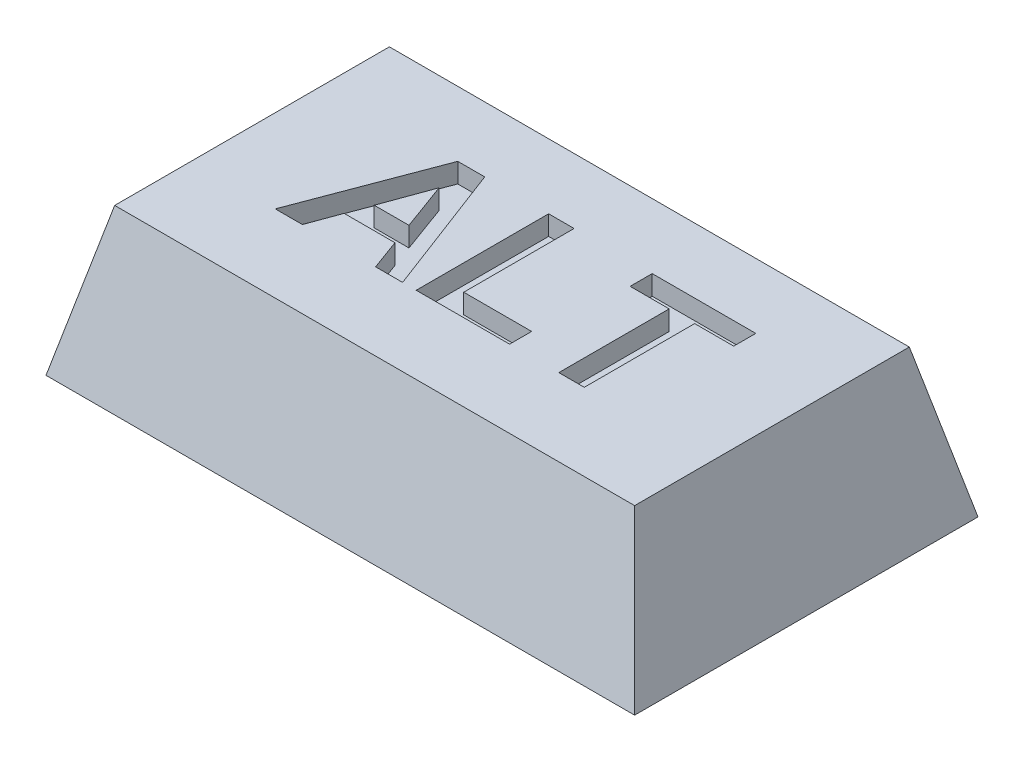
from build123d import *

# Parameters (mm, degrees)
SKETCH1_W               = 12
SKETCH1_H               = 7
BOSS_EXTRUDE1_DEPTH     = 3
CUT_EXTRUDE1_DEPTH      = 7
CUT_EXTRUDE2_DEPTH      = 15.212670404
CUT_EXTRUDE2_DEPTH_BACK = 15.212670404
SKETCH4_R               = 1.8
CUT_EXTRUDE3_DEPTH      = 0.8
CUT_EXTRUDE4_DEPTH      = 0.4


with BuildPart() as part:
    # Sketch1 → Boss-Extrude1 (new body)
    with BuildSketch(Plane(origin=(0, 0, 0), x_dir=(1, 0, 0), z_dir=(0, 1, 0))):
        with Locations((6, 3.5)):
            Rectangle(SKETCH1_W, SKETCH1_H)
    extrude(amount=BOSS_EXTRUDE1_DEPTH)

    # Sketch2 → Cut-Extrude1 (cut)
    with BuildSketch(Plane.XY):
        Polygon((0, 0), (0.7, 3), (0, 3), align=None)
        Polygon((12, 0), (11.3, 3), (12, 3), align=None)
    extrude(amount=-CUT_EXTRUDE1_DEPTH, mode=Mode.SUBTRACT)

    # Sketch3 → Cut-Extrude2 (cut, two sides: drawn at the far end of the back side and taken through both)
    with BuildSketch(Plane(origin=(0, 0, 0), x_dir=(0, 0, -1), z_dir=(1, 0, 0)).offset(-CUT_EXTRUDE2_DEPTH_BACK)):
        Polygon((0, 0), (0.7, 3), (0, 3), align=None)
        Polygon((7, 3), (6.3, 3), (7, 0), align=None)
    extrude(amount=CUT_EXTRUDE2_DEPTH + CUT_EXTRUDE2_DEPTH_BACK, mode=Mode.SUBTRACT)

    # Sketch4 → Cut-Extrude3 (cut)
    with BuildSketch(Plane.XZ):
        with Locations(Location((6, -3.5, 0), (0, 0, 270))):
            Circle(SKETCH4_R)
    extrude(amount=-CUT_EXTRUDE3_DEPTH, mode=Mode.SUBTRACT)

    # Sketch5 → Cut-Extrude4 (cut)
    # profile 1 of 3: a face of its own
    with BuildSketch(Plane(origin=(0, 3, 0), x_dir=(1, 0, 0), z_dir=(0, 1, 0))):
        Polygon((4.994280794, 2.275548034), (4.443679833, 2.275548034), (4.215975506, 2.898624958), (3.179677429, 2.898624958), (2.951973102, 2.275548034), (2.398126948, 2.275548034), (3.418739929, 4.975548034), (3.968800025, 4.975548034), align=None)
        Polygon((4.051011564, 3.348624958), (3.696203871, 4.317855727), (3.34247791, 3.348624958), align=None, mode=Mode.SUBTRACT)
    # profile 2 of 3: a face of its own
    with BuildSketch(Plane(origin=(0, 3, 0), x_dir=(1, 0, 0), z_dir=(0, 1, 0))):
        Polygon((5.271203871, 2.275548034), (5.271203871, 4.975548034), (5.79043464, 4.975548034), (5.79043464, 2.725548034), (7.175050025, 2.725548034), (7.175050025, 2.275548034), align=None)
    # profile 3 of 3: a face of its own
    with BuildSketch(Plane(origin=(0, 3, 0), x_dir=(1, 0, 0), z_dir=(0, 1, 0))):
        Polygon((8.178896179, 2.275548034), (8.178896179, 4.525548034), (7.382742333, 4.525548034), (7.382742333, 4.975548034), (9.494280794, 4.975548034), (9.494280794, 4.525548034), (8.698126948, 4.525548034), (8.698126948, 2.275548034), align=None)
    extrude(amount=-CUT_EXTRUDE4_DEPTH, mode=Mode.SUBTRACT)


solid = part.part
